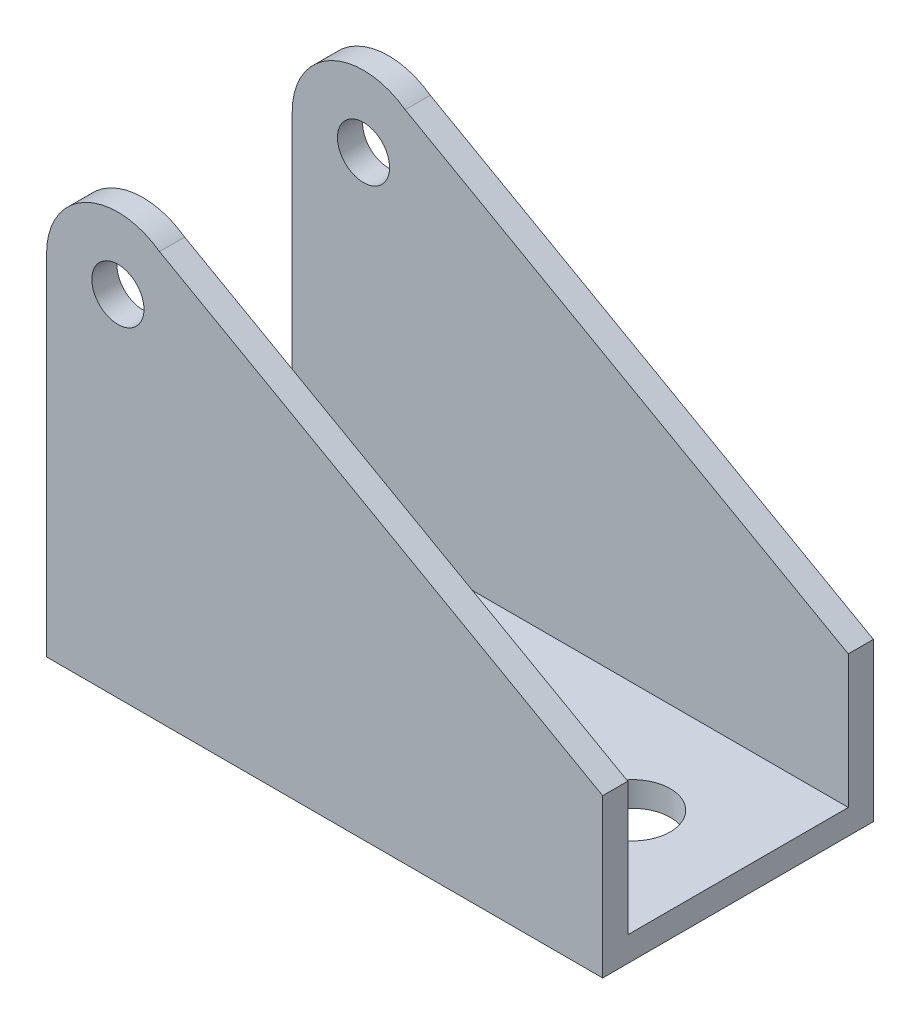
from build123d import *

# Parameters (mm, degrees)
SKETCH_1_R          = 2.72
EXTRUDE_4_DEPTH     = 28.26
CUT_EXTRUDE_1_DEPTH = 11.51
SKETCH_3_R          = 3.92
CUT_EXTRUDE_2_DEPTH = 10


with BuildPart() as part:
    # 草图1 → 凸台-拉伸4 (new body)
    with BuildSketch(Plane.XY):
        with BuildLine():
            Line((-34.509354159, -1.804921221), (-34.509354159, -38.304921221))
            Line((-34.509354159, -38.304921221), (23.530645841, -38.304921221))
            Line((23.530645841, -38.304921221), (23.530645841, -21.824921221))
            Line((23.530645841, -21.824921221), (-22.721234155, 4.232251332))
            ThreePointArc((-22.721234155, 4.232251332), (-30.46078359, 4.817148427), (-34.509354159, -1.804921221))
        make_face()
        with Locations((-27.069354159, -1.804921221)):
            Circle(SKETCH_1_R, mode=Mode.SUBTRACT)
    extrude(amount=EXTRUDE_4_DEPTH)

    # 草图2 → 切除-拉伸1 (cut, symmetric)
    with BuildSketch(Plane.XY.offset(14.13)):
        with BuildLine():
            Line((-35.9562977, -0.339763977), (-37.696904617, -35.707625719))
            Line((-37.696904617, -35.707625719), (23.935381019, -35.707625719))
            Line((23.935381019, -35.707625719), (23.935381019, -19.579879512))
            Line((23.935381019, -19.579879512), (-18.750112631, 5.187829847))
            ThreePointArc((-18.750112631, 5.187829847), (-29.978908557, 10.597270683), (-35.9562977, -0.339763977))
        make_face()
    extrude(amount=CUT_EXTRUDE_1_DEPTH, both=True, mode=Mode.SUBTRACT)

    # 草图3 → 切除-拉伸2 (cut)
    with BuildSketch(Plane(origin=(0, -35.707625719, 0), x_dir=(1, 0, 0), z_dir=(0, 1, 0))):
        with Locations(Location((12.530645841, -14.13, 0), (0, 0, 270))):
            Circle(SKETCH_3_R)
        with BuildLine():
            ThreePointArc((-26.319354159, -18.22), (-22.229354159, -14.13), (-26.319354159, -10.04))
            Line((-26.319354159, -10.04), (-34.509354159, -10.04))
            Line((-34.509354159, -10.04), (-34.509354159, -18.22))
            Line((-34.509354159, -18.22), (-26.319354159, -18.22))
        make_face()
    extrude(amount=-CUT_EXTRUDE_2_DEPTH, mode=Mode.SUBTRACT)


solid = part.part
